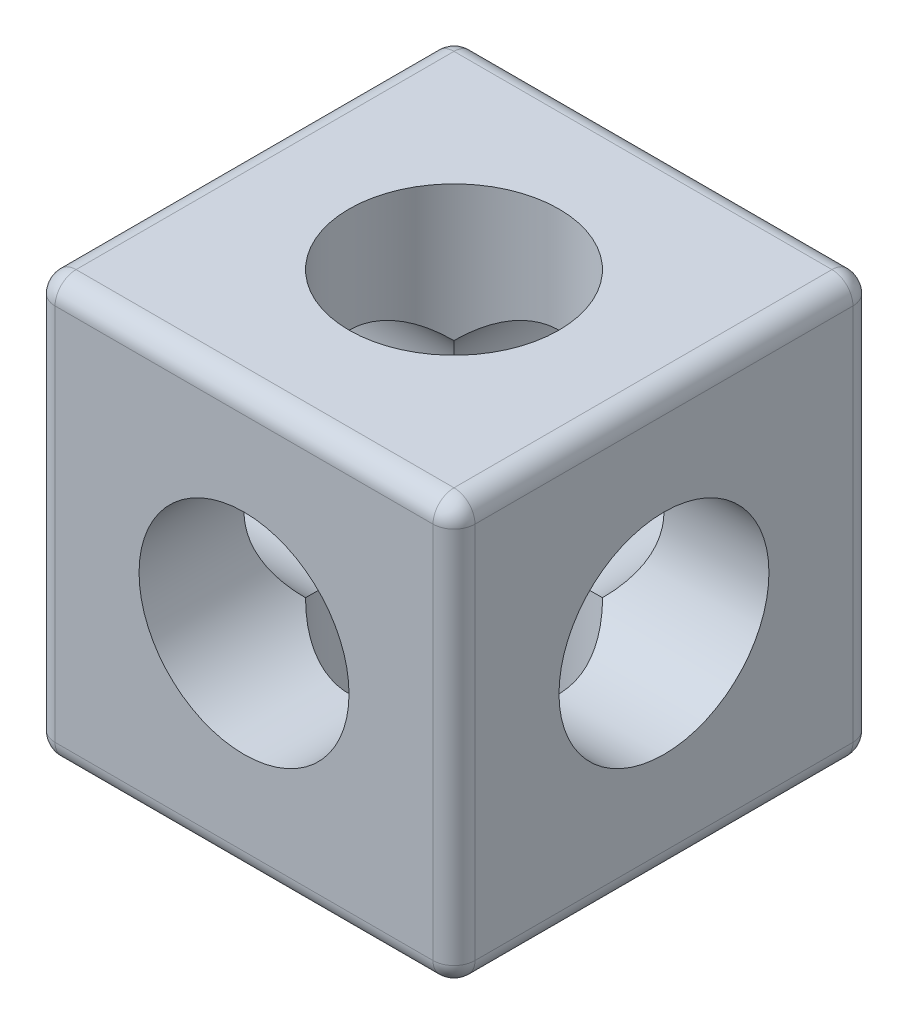
from build123d import *

# Parameters (mm, degrees)
SKETCH1_W           = 4
SKETCH1_H           = 4
BOSS_EXTRUDE1_DEPTH = 4
CUT_EXTRUDE1_REACH  = 8
SKETCH2_R           = 1
SKETCH3_R           = 1
CUT_EXTRUDE2_DEPTH  = 5.898979486
SKETCH4_R           = 1
CUT_EXTRUDE3_DEPTH  = 7
FILLET1_R           = 0.2


with BuildPart() as part:
    # Sketch1 → Boss-Extrude1 (new body)
    with BuildSketch(Plane.XY):
        Rectangle(SKETCH1_W, SKETCH1_H)
    extrude(amount=BOSS_EXTRUDE1_DEPTH)

    # Sketch2 → Cut-Extrude1 (cut, up to next)
    with BuildSketch(Plane(origin=(0, 2, 0), x_dir=(1, 0, 0), z_dir=(0, 1, 0)), mode=Mode.PRIVATE) as cut_extrude1_sk1:
        with Locations(Location((0, -2, 0), (0, 0, 180))):
            Circle(SKETCH2_R)
    cut_extrude1_tool1 = extrude(cut_extrude1_sk1.sketch, amount=-CUT_EXTRUDE1_REACH, mode=Mode.PRIVATE) & part.part
    add(cut_extrude1_tool1.solids().sort_by_distance((0, 2, 2))[0], mode=Mode.SUBTRACT)

    # Sketch3 → Cut-Extrude2 (cut, through all)
    with BuildSketch(Plane.XY.offset(4)):
        Circle(SKETCH3_R)
    extrude(amount=-CUT_EXTRUDE2_DEPTH, mode=Mode.SUBTRACT)

    # Sketch4 → Cut-Extrude3 (cut, through all)
    with BuildSketch(Plane(origin=(2, 0, 0), x_dir=(0, 0, -1), z_dir=(1, 0, 0))):
        with Locations((-2, 0)):
            Circle(SKETCH4_R)
    extrude(amount=-CUT_EXTRUDE3_DEPTH, mode=Mode.SUBTRACT)

    # Fillet1
    fillet1_edges = [part.edges().sort_by_distance(p)[0] for p in [
        (2, 0, 4),
        (0, 2, 4),
        (-2, 0, 4),
        (0, 2, 0),
        (2, 0, 0),
        (0, -2, 0),
        (-2, 0, 0),
        (0, -2, 4),
        (-2, 2, 2),
        (2, 2, 2),
        (2, -2, 2),
        (-2, -2, 2),
    ]]
    fillet(fillet1_edges, radius=FILLET1_R)


solid = part.part
